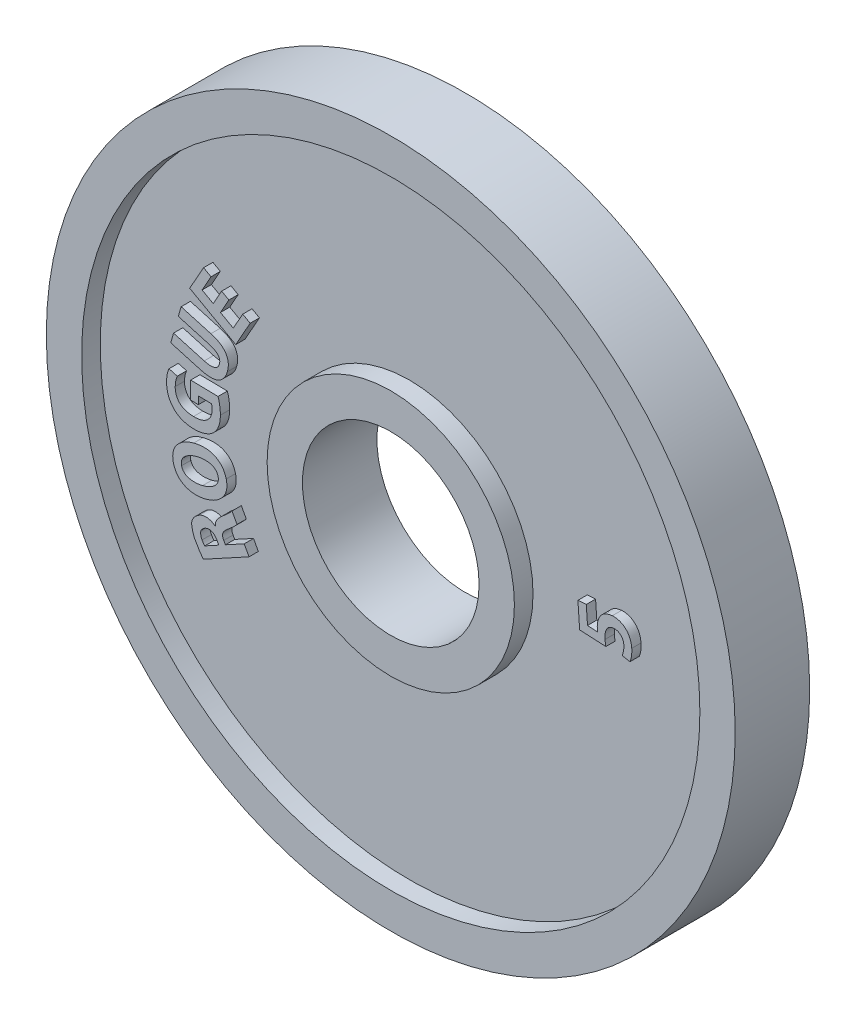
from build123d import *

# Parameters (mm, degrees)
SKETCH1_R           = 97.5
SKETCH1_R_2         = 25
BOSS_EXTRUDE1_DEPTH = 10.541
SKETCH3_R           = 87.5
SKETCH3_R_2         = 35
CUT_EXTRUDE1_DEPTH  = 5.2705
BOSS_EXTRUDE2_DEPTH = 2.63525
BOSS_EXTRUDE3_DEPTH = 2.63525


with BuildPart() as part:
    # Sketch1 → Boss-Extrude1 (new, symmetric)
    with BuildSketch(Plane.XY):
        Circle(SKETCH1_R)
        Circle(SKETCH1_R_2, mode=Mode.SUBTRACT)
    extrude(amount=BOSS_EXTRUDE1_DEPTH, both=True)

    # Sketch3 → Cut-Extrude1 (cut)
    with BuildSketch(Plane.XY.offset(10.541)):
        Circle(SKETCH3_R)
        Circle(SKETCH3_R_2, mode=Mode.SUBTRACT)
    cut_extrude1 = extrude(amount=-CUT_EXTRUDE1_DEPTH, mode=Mode.SUBTRACT)

    # Mirror1: Cut-Extrude1 across plane
    add(cut_extrude1.mirror(Plane.XY), mode=Mode.SUBTRACT)

    # Sketch4 → Boss-Extrude2 (add)
    # profile 1 of 5: a face of its own
    with BuildSketch(Plane.XY.offset(5.2705)):
        Polygon((-47.218254271, 25.408809283), (-50.841443173, 27.442045901), (-48.456665645, 31.691674006), (-50.505291145, 32.841307794), (-52.890068674, 28.591679689), (-56.039195477, 30.358885348), (-53.511901363, 34.862475292), (-55.611319231, 36.040612397), (-59.544776987, 29.031265643), (-46.525000044, 21.724915367), (-42.439524597, 29.00515475), (-44.538942466, 30.183291855), align=None)
    # profile 2 of 5: a face of its own
    with BuildSketch(Plane.XY.offset(5.2705)):
        with BuildLine():
            Line((-62.761923458, 20.525735933), (-54.080264127, 18.052005228))
            add(Edge.make_bspline(
                [(-54.080264127, 18.052005228), (-53.928382298, 18.005317332), (-53.634301247, 17.914917938), (-53.215923669, 17.759588778), (-52.832887341, 17.598526717), (-52.488547297, 17.424984551), (-52.184245321, 17.238479032), (-51.914569388, 17.046291779), (-51.686146837, 16.839540534), (-51.491203982, 16.625723557), (-51.337825654, 16.398508083), (-51.209701229, 16.166785395), (-51.122597315, 15.923222447), (-51.056588356, 15.675509764), (-51.034615389, 15.417850265), (-51.035615886, 15.154019289), (-51.073349726, 14.881490571), (-51.120956725, 14.701461594), (-51.145358038, 14.609186436)],
                knots=[0, 0, 0, 0, 1.48809851, 2.881329365, 4.178281555, 5.378732971, 6.489006905, 7.518961371, 8.475472033, 9.370044562, 10.221652238, 11.037967346, 11.842891452, 12.638585353, 13.432003418, 14.256618579, 15.106417209, 16, 16, 16, 16], degree=3))
            add(Edge.make_bspline(
                [(-51.145358038, 14.609186436), (-51.172569686, 14.522372591), (-51.225994465, 14.351930488), (-51.335905811, 14.111569287), (-51.471527219, 13.89389549), (-51.6308497, 13.698386366), (-51.811388982, 13.522038416), (-52.018713307, 13.369596899), (-52.25040081, 13.24054981), (-52.505792848, 13.133733072), (-52.783707517, 13.047915397), (-53.088739894, 12.997105652), (-53.418500069, 12.967843357), (-53.774748363, 12.973050819), (-54.15658768, 13.005006256), (-54.563980262, 13.064017112), (-54.996548551, 13.155647707), (-55.291469778, 13.232293675), (-55.443819576, 13.27188729)],
                knots=[0, 0, 0, 0, 0.860229116, 1.688892587, 2.492886047, 3.280302577, 4.06985998, 4.874439157, 5.707543869, 6.573186574, 7.489798789, 8.452736971, 9.493231604, 10.618589447, 11.818763278, 13.116985447, 14.510698302, 16, 16, 16, 16], degree=3))
            Line((-55.443819576, 13.27188729), (-64.123805308, 15.746155742))
            Line((-64.123805308, 15.746155742), (-64.911143253, 12.982960944))
            Line((-64.911143253, 12.982960944), (-56.472196978, 10.578388302))
            add(Edge.make_bspline(
                [(-56.472196978, 10.578388302), (-56.217297508, 10.510105079), (-55.723875199, 10.377925653), (-54.99312168, 10.241439115), (-54.302648266, 10.153992875), (-53.651463362, 10.125197949), (-53.040087939, 10.148157752), (-52.467971982, 10.227877379), (-51.935567227, 10.366222873), (-51.442296395, 10.556969798), (-50.990332073, 10.804630549), (-50.573251485, 11.097192854), (-50.19792012, 11.443988777), (-49.859026865, 11.837239082), (-49.556531238, 12.2791279), (-49.293882727, 12.770791008), (-49.06349479, 13.308816999), (-48.948406245, 13.691069357), (-48.889368093, 13.887157275)],
                knots=[0, 0, 0, 0, 1.339039885, 2.592049929, 3.770087551, 4.869186862, 5.896845348, 6.871613647, 7.795137488, 8.683174589, 9.548908812, 10.404878507, 11.262799463, 12.135707755, 13.034933863, 13.975032469, 14.961231606, 16, 16, 16, 16], degree=3))
            add(Edge.make_bspline(
                [(-48.889368093, 13.887157275), (-48.836206572, 14.087703787), (-48.732484682, 14.478984225), (-48.639633558, 15.065054845), (-48.604755357, 15.631509575), (-48.626391433, 16.17768336), (-48.704616183, 16.705759463), (-48.84301671, 17.212839832), (-49.038363488, 17.700577581), (-49.292197735, 18.166044249), (-49.607229664, 18.607247106), (-49.982507632, 19.023185746), (-50.426563158, 19.404584913), (-50.928004241, 19.763818415), (-51.49728826, 20.087066296), (-52.124497909, 20.38844328), (-52.816574743, 20.658092446), (-53.303882969, 20.809842408), (-53.555867841, 20.888311624)],
                knots=[0, 0, 0, 0, 1.037743903, 2.024711805, 2.963682095, 3.873620938, 4.755117135, 5.629370658, 6.49787759, 7.378688356, 8.27595183, 9.204975444, 10.174872645, 11.19961462, 12.287198115, 13.446346852, 14.679517544, 16, 16, 16, 16], degree=3))
            Line((-53.555867841, 20.888311624), (-61.974585513, 23.288930731))
            Line((-61.974585513, 23.288930731), (-62.761923458, 20.525735933))
        make_face()
    # profile 3 of 5: a face of its own
    with BuildSketch(Plane.XY.offset(5.2705)):
        with BuildLine():
            Line((-59.354528788, 1.760823677), (-57.083440782, 1.721340451))
            Line((-57.083440782, 1.721340451), (-57.045982337, 3.875962405))
            Line((-57.045982337, 3.875962405), (-53.396712721, 3.812519272))
            add(Edge.make_bspline(
                [(-53.396712721, 3.812519272), (-53.38237971, 3.7748416), (-53.351717788, 3.694239567), (-53.311157556, 3.561244897), (-53.283442176, 3.406282901), (-53.253064162, 3.231640844), (-53.235627082, 3.035291113), (-53.221374865, 2.818925239), (-53.213074078, 2.581874654), (-53.212121442, 2.416997266), (-53.21162361, 2.330835146)],
                knots=[0, 0, 0, 0, 0.644230047, 1.3781704, 2.217596726, 3.157475149, 4.210314123, 5.365116427, 6.623054638, 8, 8, 8, 8], degree=3))
            add(Edge.make_bspline(
                [(-53.21162361, 2.330835146), (-53.217783665, 2.176968419), (-53.229867049, 1.875147935), (-53.30210281, 1.435717818), (-53.411822887, 1.018744649), (-53.561010724, 0.623969076), (-53.749751818, 0.249937073), (-53.982294736, -0.099486041), (-54.253634489, -0.42799453), (-54.566543772, -0.730923371), (-54.916810093, -1.008590993), (-55.312437944, -1.243721645), (-55.744044738, -1.448508875), (-56.218103761, -1.608671379), (-56.730187732, -1.735854619), (-57.280969234, -1.823465498), (-57.871395201, -1.878021535), (-58.27787514, -1.883383472), (-58.48777444, -1.886152285)],
                knots=[0, 0, 0, 0, 0.968873611, 1.900514213, 2.797334108, 3.680065671, 4.552973396, 5.429597796, 6.317494275, 7.230739224, 8.167367869, 9.125069258, 10.122188918, 11.170230423, 12.270045487, 13.441123617, 14.678639934, 16, 16, 16, 16], degree=3))
            add(Edge.make_bspline(
                [(-58.48777444, -1.886152285), (-58.70525019, -1.874898478), (-59.12647206, -1.853101337), (-59.735596537, -1.775680316), (-60.298287141, -1.655198175), (-60.816412127, -1.497728052), (-61.29115404, -1.305110121), (-61.721249193, -1.072160924), (-62.104874994, -0.79679028), (-62.441573119, -0.484419903), (-62.735446541, -0.141673409), (-62.988006951, 0.224552693), (-63.204849438, 0.611773351), (-63.375453526, 1.023277724), (-63.505210044, 1.456531981), (-63.594412157, 1.911850704), (-63.646878084, 2.389512515), (-63.646248549, 2.715598338), (-63.645928286, 2.881487735)],
                knots=[0, 0, 0, 0, 1.311989845, 2.541151439, 3.695612222, 4.775616457, 5.800548064, 6.777890139, 7.716010406, 8.638503228, 9.538913111, 10.431204385, 11.315338524, 12.20828985, 13.109901505, 14.036252849, 15.000984377, 16, 16, 16, 16], degree=3))
            add(Edge.make_bspline(
                [(-63.645928286, 2.881487735), (-63.640771738, 3.038891935), (-63.630845097, 3.34190379), (-63.594168122, 3.776902659), (-63.542478697, 4.175929247), (-63.469118172, 4.538721268), (-63.380107713, 4.871878421), (-63.283015138, 5.17858638), (-63.176484831, 5.463455579), (-63.0935989, 5.640855702), (-63.053133917, 5.727462597)],
                knots=[0, 0, 0, 0, 1.289646467, 2.482641303, 3.57385909, 4.583160905, 5.51149337, 6.396850185, 7.217340862, 8, 8, 8, 8], degree=3))
            Line((-63.053133917, 5.727462597), (-65.410115978, 6.370816127))
            add(Edge.make_bspline(
                [(-65.410115978, 6.370816127), (-65.456975399, 6.273267237), (-65.555564798, 6.068030244), (-65.672594734, 5.726668006), (-65.785636836, 5.344601166), (-65.885228039, 4.919785384), (-65.970470845, 4.456922999), (-66.028638065, 3.960290299), (-66.076568535, 3.433905937), (-66.087398784, 3.072643316), (-66.092960966, 2.887106639)],
                knots=[0, 0, 0, 0, 0.725757355, 1.526949782, 2.417951061, 3.399740666, 4.453811465, 5.574863649, 6.754502364, 8, 8, 8, 8], degree=3))
            add(Edge.make_bspline(
                [(-66.092960966, 2.887106639), (-66.091101708, 2.618105732), (-66.087458026, 2.09093099), (-66.002326778, 1.317736388), (-65.864874326, 0.57783334), (-65.658696126, -0.1266898), (-65.391393885, -0.796073929), (-65.06048761, -1.429287342), (-64.667419697, -2.027167858), (-64.29239133, -2.495804508), (-63.960969561, -2.845479864), (-63.698207647, -3.094952778), (-63.420347986, -3.327405286), (-63.127508394, -3.545385931), (-62.817692236, -3.742751911), (-62.496895109, -3.930616303), (-62.159520836, -4.098486953), (-61.807862357, -4.248922211), (-61.443425821, -4.389185195), (-61.062917026, -4.508107567), (-60.667990057, -4.611861333), (-60.259679493, -4.702685342), (-59.835824373, -4.775263812), (-59.396974734, -4.830176526), (-58.944542241, -4.874002372), (-58.637702438, -4.887986407), (-58.482155536, -4.895075362)],
                knots=[0, 0, 0, 0, 1.576847851, 3.090228838, 4.555263482, 5.985758869, 7.388193311, 8.77625962, 10.168666019, 11.578898289, 12.289910222, 12.993157361, 13.702746441, 14.413503744, 15.132616234, 15.856141205, 16.59305215, 17.340955248, 18.09889561, 18.882338966, 19.677706052, 20.493298514, 21.334887522, 22.198747773, 23.086887677, 24, 24, 24, 24], degree=3))
            add(Edge.make_bspline(
                [(-58.482155536, -4.895075362), (-58.19067154, -4.893606681), (-57.618451703, -4.890723474), (-56.781404299, -4.800042472), (-55.98263948, -4.653385634), (-55.228715496, -4.438516619), (-54.525679781, -4.15985806), (-53.878029108, -3.829877667), (-53.291515543, -3.43864624), (-52.948756656, -3.129405029), (-52.778968004, -2.976219655)],
                knots=[0, 0, 0, 0, 1.133060846, 2.224341308, 3.269470148, 4.288615219, 5.268003751, 6.206326858, 7.111488116, 8, 8, 8, 8], degree=3))
            add(Edge.make_bspline(
                [(-52.778968004, -2.976219655), (-52.627706616, -2.818734548), (-52.324678461, -2.503238161), (-51.944421491, -1.962065591), (-51.616364667, -1.3776918), (-51.346059598, -0.744797386), (-51.135420371, -0.063964441), (-50.985757639, 0.665346413), (-50.888829003, 1.442403432), (-50.871709773, 1.977488678), (-50.86292175, 2.25217049)],
                knots=[0, 0, 0, 0, 0.9155246, 1.83410805, 2.76695777, 3.725038662, 4.717305261, 5.753563768, 6.846809587, 8, 8, 8, 8], degree=3))
            add(Edge.make_bspline(
                [(-50.86292175, 2.25217049), (-50.863665435, 2.464807282), (-50.865131068, 2.883865233), (-50.902894193, 3.502641706), (-50.966344359, 4.102870855), (-51.06007309, 4.676623976), (-51.165430271, 5.213264041), (-51.277456449, 5.699634799), (-51.392130024, 6.13011092), (-51.483337739, 6.393742768), (-51.525952418, 6.516918605)],
                knots=[0, 0, 0, 0, 1.176782698, 2.3191666, 3.429694246, 4.516251551, 5.53589585, 6.456319124, 7.278751089, 8, 8, 8, 8], degree=3))
            Line((-51.525952418, 6.516918605), (-59.269487993, 6.652397842))
            Line((-59.269487993, 6.652397842), (-59.354528788, 1.760823677))
        make_face()
    # profile 4 of 5: a face of its own
    with BuildSketch(Plane.XY.offset(5.2705)):
        with BuildLine():
            add(Edge.make_bspline(
                [(-64.163668071, -16.142713144), (-64.093653719, -16.37333014), (-63.956826246, -16.82401975), (-63.678807716, -17.459153319), (-63.349782221, -18.041171001), (-62.961835122, -18.564631188), (-62.526872651, -19.03996593), (-62.034902777, -19.457602087), (-61.488361455, -19.817757584), (-60.895174976, -20.124291921), (-60.261122679, -20.36871572), (-59.598178546, -20.55769557), (-58.909917446, -20.687646558), (-58.195182061, -20.753620175), (-57.454869283, -20.761148025), (-56.688522964, -20.709655871), (-55.896028044, -20.597048426), (-55.364756985, -20.478192507), (-55.092954511, -20.417384879)],
                knots=[0, 0, 0, 0, 1.028593245, 2.010156646, 2.954212523, 3.878152561, 4.786728897, 5.700353041, 6.626610195, 7.576477157, 8.546491242, 9.523849107, 10.516940265, 11.533379363, 12.585340102, 13.67560823, 14.810822795, 16, 16, 16, 16], degree=3))
            add(Edge.make_bspline(
                [(-55.092954511, -20.417384879), (-54.832548462, -20.34477541), (-54.321832124, -20.202371488), (-53.588135168, -19.938014924), (-52.902812755, -19.63532127), (-52.267217068, -19.290691915), (-51.679175454, -18.909426565), (-51.138901112, -18.489024847), (-50.647973384, -18.029197785), (-50.207506981, -17.534344001), (-49.824903974, -17.007035376), (-49.517896477, -16.446510735), (-49.277958086, -15.862145313), (-49.118677765, -15.248637389), (-49.027944686, -14.610518032), (-49.013409182, -13.946250279), (-49.068233174, -13.256524168), (-49.161951774, -12.795514349), (-49.209962053, -12.559347675)],
                knots=[0, 0, 0, 0, 1.176744192, 2.307866838, 3.3921314, 4.435736319, 5.452454324, 6.440183963, 7.412330578, 8.377035116, 9.320753471, 10.242331965, 11.153204615, 12.064077266, 12.99476608, 13.953272448, 14.951499903, 16, 16, 16, 16], degree=3))
            add(Edge.make_bspline(
                [(-49.209962053, -12.559347675), (-49.271943531, -12.337773205), (-49.393705044, -11.902494095), (-49.649807257, -11.287271698), (-49.950237056, -10.71682895), (-50.305382351, -10.19628834), (-50.717309736, -9.727637296), (-51.17609294, -9.303299485), (-51.68938711, -8.931425506), (-52.249497554, -8.607450299), (-52.858441067, -8.337887514), (-53.517579601, -8.140241009), (-54.220830344, -8.006015491), (-54.968639112, -7.936687049), (-55.762001683, -7.935746466), (-56.600163137, -8.003679981), (-57.4845178, -8.132178938), (-58.082976302, -8.265339111), (-58.391251143, -8.333931888)],
                knots=[0, 0, 0, 0, 0.966871507, 1.899401907, 2.796225363, 3.674540851, 4.54263295, 5.415074181, 6.297380811, 7.202605607, 8.131970134, 9.091303948, 10.09004971, 11.138390552, 12.245120465, 13.422288709, 14.672182725, 16, 16, 16, 16], degree=3))
            add(Edge.make_bspline(
                [(-58.391251143, -8.333931888), (-58.634877515, -8.399726291), (-59.113103683, -8.528877354), (-59.801323679, -8.779580498), (-60.451903706, -9.06478385), (-61.063284656, -9.391746708), (-61.636664606, -9.75614233), (-62.165536544, -10.167009258), (-62.659296094, -10.61141816), (-63.112120544, -11.091115936), (-63.506942451, -11.609553665), (-63.831281836, -12.164216762), (-64.076599627, -12.752215653), (-64.246022715, -13.371653353), (-64.342017783, -14.022537355), (-64.358138706, -14.704686857), (-64.306695698, -15.418818436), (-64.212931344, -15.897732501), (-64.164674974, -16.144208409)],
                knots=[0, 0, 0, 0, 1.10998498, 2.178844019, 3.219407608, 4.233357713, 5.226700504, 6.20505807, 7.176623098, 8.147453788, 9.103479257, 10.037829478, 10.966903493, 11.898633014, 12.856707767, 13.854349064, 14.89572827, 16, 16, 16, 16], degree=3))
            Line((-64.164674974, -16.144208409), (-64.163668071, -16.142713144))
        make_face()
        with BuildLine():
            add(Edge.make_bspline(
                [(-61.866927354, -15.641697864), (-61.889899517, -15.510870996), (-61.9347661, -15.255355024), (-61.942990836, -14.871079415), (-61.898232125, -14.501207269), (-61.801301128, -14.145550008), (-61.653828598, -13.804328084), (-61.451591622, -13.480930478), (-61.200643597, -13.17056717), (-60.899857659, -12.88024543), (-60.565099815, -12.604802693), (-60.202466027, -12.348521774), (-59.818837261, -12.109233661), (-59.408328268, -11.893210385), (-58.976215795, -11.693913023), (-58.520012268, -11.51306998), (-58.038743541, -11.356821747), (-57.708022256, -11.267454721), (-57.539987191, -11.222048529)],
                knots=[0, 0, 0, 0, 0.928390126, 1.813224673, 2.678008924, 3.526857089, 4.383835615, 5.269446248, 6.187410836, 7.169749604, 8.18913346, 9.218243122, 10.274714298, 11.350517191, 12.461718858, 13.603095245, 14.782164726, 16, 16, 16, 16], degree=3))
            add(Edge.make_bspline(
                [(-57.539987191, -11.222048529), (-57.355886971, -11.178148365), (-56.995937122, -11.092315454), (-56.46155338, -10.996013131), (-55.944498899, -10.934798225), (-55.445662768, -10.899640016), (-54.964243726, -10.896411263), (-54.501406103, -10.923944026), (-54.056350135, -10.983044878), (-53.630862829, -11.070746385), (-53.232852709, -11.192500546), (-52.869230337, -11.349056978), (-52.545842752, -11.544952497), (-52.259542374, -11.774291103), (-52.008281632, -12.036541682), (-51.802723071, -12.339988489), (-51.631802461, -12.676046332), (-51.551781173, -12.918644809), (-51.510903229, -13.042573416)],
                knots=[0, 0, 0, 0, 1.299445988, 2.540656323, 3.725917938, 4.873151768, 5.972792471, 7.02935932, 8.054319209, 9.053186824, 10.009154939, 10.907591004, 11.764494802, 12.59704454, 13.420379374, 14.248022268, 15.105022575, 16, 16, 16, 16], degree=3))
            add(Edge.make_bspline(
                [(-51.510903229, -13.042573416), (-51.487723574, -13.170449095), (-51.442462378, -13.420142457), (-51.434973583, -13.795875832), (-51.477526284, -14.158612989), (-51.567760732, -14.510799511), (-51.709705848, -14.850410983), (-51.903972004, -15.176428632), (-52.14828112, -15.488793103), (-52.437547169, -15.787829996), (-52.76726862, -16.069325832), (-53.12564915, -16.336851807), (-53.516441849, -16.580345601), (-53.932846518, -16.809463181), (-54.380229949, -17.016278955), (-54.855948147, -17.204140725), (-55.360187519, -17.374176184), (-55.709528588, -17.467523716), (-55.888029423, -17.515220978)],
                knots=[0, 0, 0, 0, 0.898126993, 1.753706023, 2.58882011, 3.418663216, 4.261061395, 5.126788493, 6.036690211, 6.999093576, 8.000665499, 9.033588274, 10.090700228, 11.183975841, 12.320414641, 13.498453995, 14.721799152, 16, 16, 16, 16], degree=3))
            add(Edge.make_bspline(
                [(-55.888029423, -17.515220978), (-56.058036256, -17.556615702), (-56.391597538, -17.63783407), (-56.892189564, -17.722704013), (-57.380219053, -17.787274497), (-57.858848437, -17.816952376), (-58.327077539, -17.821711491), (-58.783853989, -17.79189719), (-59.230893738, -17.73990138), (-59.66269494, -17.657401173), (-60.071551407, -17.542404001), (-60.446475127, -17.388330353), (-60.782031897, -17.192512869), (-61.079381378, -16.958277947), (-61.337553771, -16.684896174), (-61.558876992, -16.375664519), (-61.74138678, -16.026793947), (-61.825985233, -15.773811592), (-61.869352701, -15.644125955)],
                knots=[0, 0, 0, 0, 1.207584144, 2.369336034, 3.503230226, 4.604606082, 5.677842333, 6.733644942, 7.762499752, 8.783197011, 9.76539099, 10.689909057, 11.573651914, 12.438969739, 13.294156878, 14.16070558, 15.057127648, 16, 16, 16, 16], degree=3))
            Line((-61.869352701, -15.644125955), (-61.866927354, -15.641697864))
        make_face(mode=Mode.SUBTRACT)
    # profile 5 of 5: a face of its own
    with BuildSketch(Plane.XY.offset(5.2705)):
        with BuildLine():
            Line((-42.748918021, -28.410762517), (-44.115332308, -25.904997475))
            Line((-44.115332308, -25.904997475), (-49.433690764, -28.805142083))
            Line((-49.433690764, -28.805142083), (-49.898457528, -27.952841048))
            add(Edge.make_bspline(
                [(-49.898457528, -27.952841048), (-49.936867638, -27.881237084), (-50.011559276, -27.741997248), (-50.105181661, -27.531708439), (-50.175013524, -27.324114095), (-50.215297656, -27.118971942), (-50.239315911, -26.918881747), (-50.240310467, -26.722489357), (-50.213748023, -26.530228665), (-50.165961442, -26.339400701), (-50.090683799, -26.148280704), (-49.989234568, -25.954106417), (-49.85672925, -25.757378131), (-49.702761775, -25.551471142), (-49.518814792, -25.341097896), (-49.30747223, -25.124831394), (-49.068562398, -24.903494708), (-48.897101399, -24.7579698), (-48.808499901, -24.68277063)],
                knots=[0, 0, 0, 0, 1.013138644, 1.970131939, 2.867618962, 3.738023536, 4.572503857, 5.378378179, 6.179499039, 6.986810837, 7.826180734, 8.735145426, 9.713425069, 10.780919117, 11.940060316, 13.195466918, 14.550773451, 16, 16, 16, 16], degree=3))
            add(Edge.make_bspline(
                [(-48.808499901, -24.68277063), (-48.637547311, -24.540089611), (-48.309607078, -24.266383046), (-47.847199188, -23.86415103), (-47.428818706, -23.494138752), (-47.065067466, -23.151477461), (-46.752940651, -22.846236678), (-46.499102466, -22.58402853), (-46.29996163, -22.368905514), (-46.197680554, -22.232681868), (-46.153567775, -22.173930006)],
                knots=[0, 0, 0, 0, 1.460571918, 2.801831157, 4.020043122, 5.123882678, 6.079529805, 6.883214606, 7.518341909, 8, 8, 8, 8], degree=3))
            Line((-46.153567775, -22.173930006), (-47.563901697, -19.580923798))
            add(Edge.make_bspline(
                [(-47.563901697, -19.580923798), (-47.591602066, -19.618652069), (-47.65039076, -19.698723051), (-47.753097512, -19.820224784), (-47.874996873, -19.951429091), (-48.011781784, -20.097445165), (-48.166721902, -20.255382679), (-48.340958678, -20.423004953), (-48.532858627, -20.602844533), (-48.81306315, -20.865013852), (-49.188826234, -21.204550426), (-49.655897838, -21.629961309), (-50.143053704, -22.073860026), (-50.477981632, -22.372763486), (-50.648690952, -22.525111505)],
                knots=[0, 0, 0, 0, 0.39462629, 0.837518237, 1.340605684, 1.904873568, 2.524761332, 3.206143308, 3.943615589, 4.742665323, 6.442106328, 8.21432531, 10.070480543, 12, 12, 12, 12], degree=3))
            add(Edge.make_bspline(
                [(-50.648690952, -22.525111505), (-50.787434495, -22.651335562), (-51.055163901, -22.894906479), (-51.410299338, -23.281243951), (-51.71058434, -23.666663915), (-51.955779787, -24.052233635), (-52.14141179, -24.443374411), (-52.254031091, -24.844922189), (-52.306027078, -25.254992329), (-52.285634182, -25.52838788), (-52.275363652, -25.666078825)],
                knots=[0, 0, 0, 0, 1.220691575, 2.355533275, 3.411649753, 4.397873312, 5.325336499, 6.218934627, 7.102997201, 8, 8, 8, 8], degree=3))
            Line((-52.275363652, -25.666078825), (-52.324786961, -25.693333802))
            add(Edge.make_bspline(
                [(-52.324786961, -25.693333802), (-52.475694498, -25.576686575), (-52.775665845, -25.344817272), (-53.281077852, -25.077326588), (-53.822623888, -24.878943282), (-54.29997009, -24.775649209), (-54.693328235, -24.727861521), (-54.993232971, -24.724891178), (-55.294240548, -24.739096139), (-55.596095208, -24.787293888), (-55.900424448, -24.852510901), (-56.204034588, -24.950129187), (-56.509352662, -25.070815269), (-56.708397532, -25.169229714), (-56.809819157, -25.219375959)],
                knots=[0, 0, 0, 0, 1.430083694, 2.842695199, 4.273169088, 5.749053686, 6.499207937, 7.244733604, 7.998340639, 8.759131266, 9.537114348, 10.333316701, 11.15075566, 12, 12, 12, 12], degree=3))
            add(Edge.make_bspline(
                [(-56.809819157, -25.219375959), (-56.908800081, -25.283035003), (-57.103117709, -25.408009333), (-57.377205111, -25.607638774), (-57.631792645, -25.809424201), (-57.861775835, -26.017627689), (-58.07163469, -26.229060328), (-58.258994841, -26.445840397), (-58.430032797, -26.663600408), (-58.572464638, -26.890291758), (-58.69650061, -27.118207754), (-58.803008866, -27.348704062), (-58.88066051, -27.586922007), (-58.939271422, -27.828329494), (-58.981158631, -28.073288297), (-58.99155786, -28.322708907), (-58.992621798, -28.575636534), (-58.94942058, -28.914359269), (-58.878956053, -29.329524299), (-58.778543254, -29.813405218), (-58.661052091, -30.273870697), (-58.526206444, -30.712180103), (-58.371628537, -31.127406719), (-58.201002969, -31.520857218), (-58.012506467, -31.891658493), (-57.871347654, -32.124884521), (-57.801555708, -32.240196472)],
                knots=[0, 0, 0, 0, 1.046473556, 2.0544187, 3.014386448, 3.934353183, 4.811905991, 5.662034119, 6.481667428, 7.271868455, 8.039627635, 8.788912532, 9.526392521, 10.263731397, 10.997675421, 11.73180846, 12.481463604, 13.243964097, 14.763861685, 16.227490176, 17.637526504, 18.989005782, 20.304062965, 21.576000528, 22.801522662, 24, 24, 24, 24], degree=3))
            add(Edge.make_bspline(
                [(-57.801555708, -32.240196472), (-57.625234635, -32.552600309), (-57.281346094, -33.161898432), (-56.822118916, -33.89118075), (-56.454438175, -34.431972287), (-56.192746364, -34.804215824), (-55.94057452, -35.147649086), (-55.77087042, -35.363790016), (-55.688847815, -35.468256804)],
                knots=[0, 0, 0, 0, 1.671707361, 3.26042141, 4.014589502, 4.719336605, 5.38102056, 6, 6, 6, 6], degree=3))
            Line((-55.688847815, -35.468256804), (-42.748918021, -28.410762517))
        make_face()
        with BuildLine():
            add(Edge.make_bspline(
                [(-55.297521882, -32.00273742), (-55.348811253, -31.949114317), (-55.46792513, -31.824580609), (-55.633695445, -31.579453589), (-55.832068112, -31.268127909), (-55.962856935, -31.030236358), (-56.034410409, -30.900087875)],
                knots=[0, 0, 0, 0, 0.668375546, 1.552228069, 2.660844388, 4, 4, 4, 4], degree=3))
            add(Edge.make_bspline(
                [(-56.034410409, -30.900087875), (-56.100959423, -30.77728785), (-56.233925291, -30.531931672), (-56.366044308, -30.129319106), (-56.436653202, -29.703475864), (-56.455454944, -29.334703515), (-56.426280883, -29.033776076), (-56.362168408, -28.811029974), (-56.261794405, -28.594143349), (-56.123685374, -28.384818751), (-55.947989375, -28.182031114), (-55.736231425, -27.987589714), (-55.491193509, -27.793595255), (-55.307136378, -27.680421789), (-55.211240977, -27.621457407)],
                knots=[0, 0, 0, 0, 1.303074611, 2.60356142, 3.935632301, 5.327872645, 6.040984291, 6.750112343, 7.482242224, 8.266136821, 9.085185507, 9.982860539, 10.949052413, 12, 12, 12, 12], degree=3))
            add(Edge.make_bspline(
                [(-55.211240977, -27.621457407), (-55.133388436, -27.581237708), (-54.980960154, -27.502491151), (-54.743061372, -27.417530857), (-54.509749426, -27.351258671), (-54.277233985, -27.310153962), (-54.046231045, -27.300774177), (-53.817372669, -27.310714863), (-53.591166297, -27.347800626), (-53.368119653, -27.410420897), (-53.149636272, -27.496192657), (-52.940726688, -27.610602443), (-52.739574487, -27.747067917), (-52.545252977, -27.905566191), (-52.366123377, -28.09505484), (-52.190658223, -28.302855822), (-52.024921865, -28.53573267), (-51.926629333, -28.704157808), (-51.87642147, -28.790189433)],
                knots=[0, 0, 0, 0, 1.054341899, 2.064306702, 3.035808731, 3.974133855, 4.90017492, 5.814949775, 6.729168113, 7.654178143, 8.600940095, 9.549782771, 10.516492741, 11.526016525, 12.563019594, 13.651970383, 14.800625563, 16, 16, 16, 16], degree=3))
            Line((-51.87642147, -28.790189433), (-51.30875304, -29.827628964))
            Line((-51.30875304, -29.827628964), (-55.297521882, -32.00273742))
        make_face(mode=Mode.SUBTRACT)
    extrude(amount=BOSS_EXTRUDE2_DEPTH)

    # Sketch5 → Boss-Extrude3 (add)
    with BuildSketch(Plane.XY.offset(5.2705)):
        with BuildLine():
            add(Edge.make_bspline(
                [(58.236023866, 0.086550905), (58.212974104, 0.205409358), (58.164505909, 0.455340561), (58.107057963, 0.848163948), (58.059271563, 1.275516573), (58.035678547, 1.571036233), (58.023410905, 1.724697363)],
                knots=[0, 0, 0, 0, 0.87883123, 1.847974135, 2.881012769, 4, 4, 4, 4], degree=3))
            add(Edge.make_bspline(
                [(58.023410905, 1.724697363), (58.014966789, 1.87542494), (57.998609817, 2.167397092), (58.005750463, 2.59327218), (58.031601611, 2.993255598), (58.085476366, 3.366758921), (58.159306907, 3.714260149), (58.261796596, 4.033416468), (58.383763692, 4.327525517), (58.533500919, 4.593028941), (58.705653555, 4.830012401), (58.897534135, 5.041011981), (59.114083433, 5.221341691), (59.349433647, 5.378725762), (59.611944573, 5.497363205), (59.89172781, 5.594424453), (60.193420506, 5.662091299), (60.402708992, 5.68350056), (60.509775912, 5.694453019)],
                knots=[0, 0, 0, 0, 1.364939999, 2.644005026, 3.849707563, 4.987639245, 6.054239769, 7.058734017, 8.015193854, 8.929196247, 9.808474896, 10.659687945, 11.501238401, 12.351650427, 13.21179231, 14.098383511, 15.027179066, 16, 16, 16, 16], degree=3))
            add(Edge.make_bspline(
                [(60.509775912, 5.694453019), (60.612845846, 5.69654952), (60.814745899, 5.700656281), (61.109226794, 5.671351203), (61.386916225, 5.618477807), (61.648308947, 5.539659537), (61.892759099, 5.433345701), (62.119847466, 5.298786118), (62.331622232, 5.142386162), (62.522211677, 4.957697802), (62.694572315, 4.756251528), (62.851405755, 4.542644907), (62.981703175, 4.314094244), (63.096314011, 4.076284651), (63.187798018, 3.826563147), (63.261551976, 3.565630707), (63.316184621, 3.293296839), (63.333119657, 3.106239878), (63.341703514, 3.011426372)],
                knots=[0, 0, 0, 0, 1.133044099, 2.219480073, 3.247716013, 4.238269745, 5.216157062, 6.171876638, 7.135996363, 8.104946047, 9.083646757, 10.04996491, 11.014579719, 11.972904573, 12.95062913, 13.935381934, 14.953507656, 16, 16, 16, 16], degree=3))
            add(Edge.make_bspline(
                [(63.341703514, 3.011426372), (63.347183362, 2.870980343), (63.357961661, 2.594737401), (63.344126126, 2.185320898), (63.301086242, 1.79049998), (63.237734003, 1.412242962), (63.152688458, 1.060821649), (63.062811315, 0.739420907), (62.970542075, 0.451632274), (62.894447654, 0.276385359), (62.858477773, 0.193546031)],
                knots=[0, 0, 0, 0, 1.169227218, 2.299750073, 3.404632676, 4.471720716, 5.488549589, 6.411179018, 7.248963311, 8, 8, 8, 8], degree=3))
            Line((62.858477773, 0.193546031), (65.068726327, -0.213764148))
            add(Edge.make_bspline(
                [(65.068726327, -0.213764148), (65.111744574, -0.111356096), (65.20238397, 0.104417547), (65.313369094, 0.458872508), (65.410398857, 0.85788855), (65.493286583, 1.297608487), (65.559083487, 1.770824026), (65.593850995, 2.269110499), (65.603382007, 2.789695098), (65.586613765, 3.142576496), (65.578027295, 3.323275543)],
                knots=[0, 0, 0, 0, 0.739223887, 1.557543842, 2.469426102, 3.472173104, 4.53561897, 5.648423019, 6.795834171, 8, 8, 8, 8], degree=3))
            add(Edge.make_bspline(
                [(65.578027295, 3.323275543), (65.55408318, 3.53446838), (65.50730785, 3.94703801), (65.384883741, 4.543302148), (65.227602342, 5.103308946), (65.020140909, 5.622329727), (64.776398934, 6.104873178), (64.491548735, 6.549382243), (64.164023325, 6.954052789), (63.795465685, 7.314340284), (63.399324143, 7.634929291), (62.981551447, 7.911853034), (62.541619566, 8.135804305), (62.087668685, 8.323194974), (61.609592503, 8.452891539), (61.114199439, 8.540462475), (60.599297236, 8.581467151), (60.251331065, 8.569162977), (60.074310855, 8.562903497)],
                knots=[0, 0, 0, 0, 1.199095933, 2.342459019, 3.431509258, 4.477803048, 5.491893353, 6.478616039, 7.451868692, 8.423641898, 9.382026468, 10.324656825, 11.246610321, 12.164326883, 13.091492825, 14.036077252, 15.000897076, 16, 16, 16, 16], degree=3))
            add(Edge.make_bspline(
                [(60.074310855, 8.562903497), (59.884547537, 8.540277589), (59.51623484, 8.496362836), (58.98822336, 8.372903288), (58.500766078, 8.215172065), (58.054632289, 8.014327582), (57.650862197, 7.773269526), (57.290711217, 7.488583774), (56.969266292, 7.166964056), (56.696119671, 6.802552729), (56.463065634, 6.41311236), (56.261681631, 6.008335532), (56.094706938, 5.589917154), (55.96890947, 5.154920408), (55.878256807, 4.706656548), (55.82687795, 4.244248847), (55.803820721, 3.768001218), (55.822541662, 3.44685377), (55.832038356, 3.283943215)],
                knots=[0, 0, 0, 0, 1.201968745, 2.332907935, 3.406487554, 4.422067826, 5.405586858, 6.358318417, 7.304390507, 8.259234555, 9.2164768, 10.157486445, 11.102033456, 12.047664812, 13.003599696, 13.976678884, 14.973616736, 16, 16, 16, 16], degree=3))
            add(Edge.make_bspline(
                [(55.832038356, 3.283943215), (55.843067103, 3.143973646), (55.864510213, 2.871831872), (55.920185731, 2.604605813), (55.947225887, 2.474821043)],
                knots=[0, 0, 0, 0, 1.02865184, 2, 2, 2, 2], degree=3))
            Line((55.947225887, 2.474821043), (53.054019858, 2.662661991))
            Line((53.054019858, 2.662661991), (52.705697196, 7.640009494))
            Line((52.705697196, 7.640009494), (50.342909666, 7.47465788))
            Line((50.342909666, 7.47465788), (50.833543142, 0.463763732))
            Line((50.833543142, 0.463763732), (58.236023866, 0.086550905))
        make_face()
    extrude(amount=BOSS_EXTRUDE3_DEPTH)


solid = part.part
